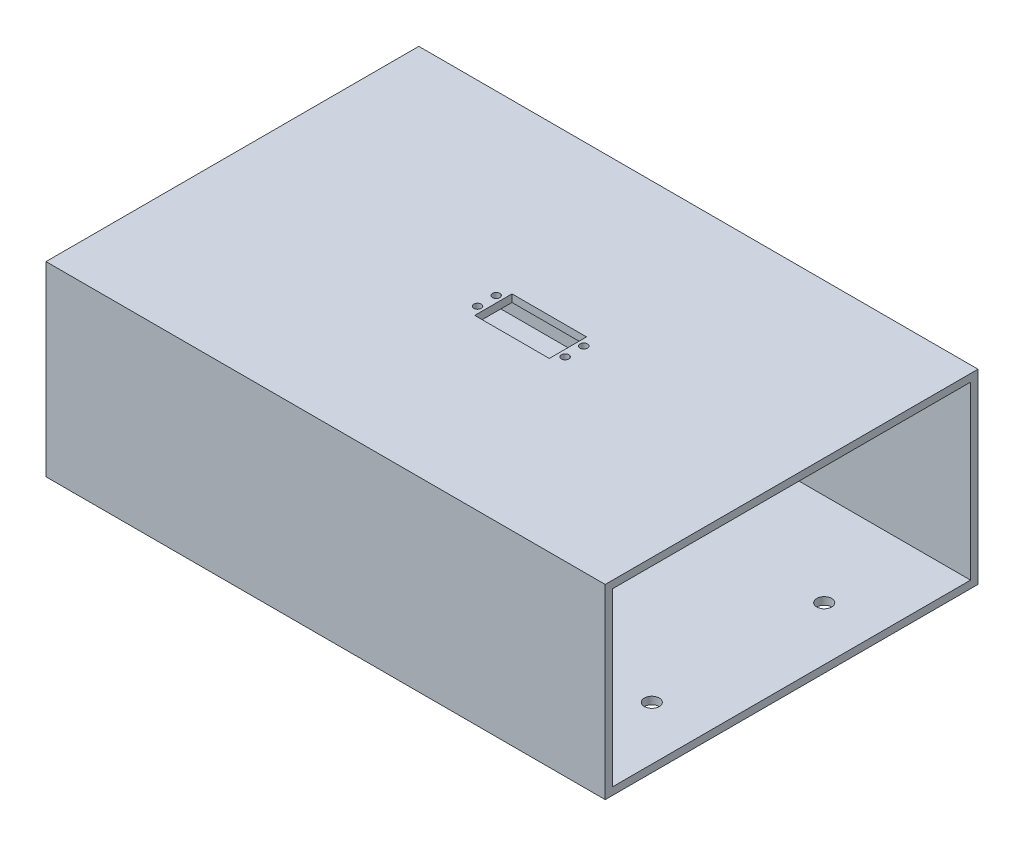
from build123d import *

# Parameters (mm, degrees)
IZIM1_W                     = 300
IZIM1_H                     = 100
Y_KSEKLIK_EKSTR_ZYON1_DEPTH = 200
BO_ALTMA1_T                 = -4
KES_EKSTR_ZYON1_REACH       = 376.166
IZIM2_R                     = 4
KES_EKSTR_ZYON2_REACH       = 376.166
IZIM3_R                     = 2
IZIM3_W                     = 40
IZIM3_H                     = 20


with BuildPart() as part:
    # Çizim1 → Yükseklik-Ekstrüzyon1 (new body)
    with BuildSketch(Plane.XY):
        with Locations((-150, 50)):
            Rectangle(IZIM1_W, IZIM1_H)
    extrude(amount=Y_KSEKLIK_EKSTR_ZYON1_DEPTH)

    # İç Boşaltma1
    bo_altma1_openings = [part.faces().sort_by_distance(p)[0] for p in [
        (-300, 50, 100),
        (0, 50, 100),
    ]]
    offset(amount=BO_ALTMA1_T, openings=bo_altma1_openings, kind=Kind.INTERSECTION)

    # Çizim2 → Kes-Ekstrüzyon1 (cut, up to next)
    with BuildSketch(Plane.XZ, mode=Mode.PRIVATE) as kes_ekstr_zyon1_sk1:
        with Locations((-271.25, 146.25)):
            Circle(IZIM2_R)
    kes_ekstr_zyon1_tool1 = extrude(kes_ekstr_zyon1_sk1.sketch, amount=-KES_EKSTR_ZYON1_REACH, mode=Mode.PRIVATE) & part.part
    # Çizim2 → Kes-Ekstrüzyon1 (cut, up to next)
    with BuildSketch(Plane.XZ, mode=Mode.PRIVATE) as kes_ekstr_zyon1_sk2:
        with Locations((-178.75, 146.25)):
            Circle(IZIM2_R)
    kes_ekstr_zyon1_tool2 = extrude(kes_ekstr_zyon1_sk2.sketch, amount=-KES_EKSTR_ZYON1_REACH, mode=Mode.PRIVATE) & part.part
    # Çizim2 → Kes-Ekstrüzyon1 (cut, up to next)
    with BuildSketch(Plane.XZ, mode=Mode.PRIVATE) as kes_ekstr_zyon1_sk3:
        with Locations(Location((-28.75, 146.25, 0), (0, 0, 180))):
            Circle(IZIM2_R)
    kes_ekstr_zyon1_tool3 = extrude(kes_ekstr_zyon1_sk3.sketch, amount=-KES_EKSTR_ZYON1_REACH, mode=Mode.PRIVATE) & part.part
    # Çizim2 → Kes-Ekstrüzyon1 (cut, up to next)
    with BuildSketch(Plane.XZ, mode=Mode.PRIVATE) as kes_ekstr_zyon1_sk4:
        with Locations(Location((-121.25, 146.25, 0), (0, 0, 180))):
            Circle(IZIM2_R)
    kes_ekstr_zyon1_tool4 = extrude(kes_ekstr_zyon1_sk4.sketch, amount=-KES_EKSTR_ZYON1_REACH, mode=Mode.PRIVATE) & part.part
    # Çizim2 → Kes-Ekstrüzyon1 (cut, up to next)
    with BuildSketch(Plane.XZ, mode=Mode.PRIVATE) as kes_ekstr_zyon1_sk5:
        with Locations((-271.25, 53.75)):
            Circle(IZIM2_R)
    kes_ekstr_zyon1_tool5 = extrude(kes_ekstr_zyon1_sk5.sketch, amount=-KES_EKSTR_ZYON1_REACH, mode=Mode.PRIVATE) & part.part
    # Çizim2 → Kes-Ekstrüzyon1 (cut, up to next)
    with BuildSketch(Plane.XZ, mode=Mode.PRIVATE) as kes_ekstr_zyon1_sk6:
        with Locations((-178.75, 53.75)):
            Circle(IZIM2_R)
    kes_ekstr_zyon1_tool6 = extrude(kes_ekstr_zyon1_sk6.sketch, amount=-KES_EKSTR_ZYON1_REACH, mode=Mode.PRIVATE) & part.part
    # Çizim2 → Kes-Ekstrüzyon1 (cut, up to next)
    with BuildSketch(Plane.XZ, mode=Mode.PRIVATE) as kes_ekstr_zyon1_sk7:
        with Locations(Location((-121.25, 53.75, 0), (0, 0, 180))):
            Circle(IZIM2_R)
    kes_ekstr_zyon1_tool7 = extrude(kes_ekstr_zyon1_sk7.sketch, amount=-KES_EKSTR_ZYON1_REACH, mode=Mode.PRIVATE) & part.part
    # Çizim2 → Kes-Ekstrüzyon1 (cut, up to next)
    with BuildSketch(Plane.XZ, mode=Mode.PRIVATE) as kes_ekstr_zyon1_sk8:
        with Locations(Location((-28.75, 53.75, 0), (0, 0, 180))):
            Circle(IZIM2_R)
    kes_ekstr_zyon1_tool8 = extrude(kes_ekstr_zyon1_sk8.sketch, amount=-KES_EKSTR_ZYON1_REACH, mode=Mode.PRIVATE) & part.part
    add(kes_ekstr_zyon1_tool1.solids().sort_by_distance((-271.25, 0, 146.25))[0], mode=Mode.SUBTRACT)
    add(kes_ekstr_zyon1_tool2.solids().sort_by_distance((-178.75, 0, 146.25))[0], mode=Mode.SUBTRACT)
    add(kes_ekstr_zyon1_tool3.solids().sort_by_distance((-28.75, 0, 146.25))[0], mode=Mode.SUBTRACT)
    add(kes_ekstr_zyon1_tool4.solids().sort_by_distance((-121.25, 0, 146.25))[0], mode=Mode.SUBTRACT)
    add(kes_ekstr_zyon1_tool5.solids().sort_by_distance((-271.25, 0, 53.75))[0], mode=Mode.SUBTRACT)
    add(kes_ekstr_zyon1_tool6.solids().sort_by_distance((-178.75, 0, 53.75))[0], mode=Mode.SUBTRACT)
    add(kes_ekstr_zyon1_tool7.solids().sort_by_distance((-121.25, 0, 53.75))[0], mode=Mode.SUBTRACT)
    add(kes_ekstr_zyon1_tool8.solids().sort_by_distance((-28.75, 0, 53.75))[0], mode=Mode.SUBTRACT)

    # Çizim3 → Kes-Ekstrüzyon2 (cut, up to next)
    with BuildSketch(Plane(origin=(0, 100, 0), x_dir=(1, 0, 0), z_dir=(0, 1, 0)), mode=Mode.PRIVATE) as kes_ekstr_zyon2_sk1:
        with Locations(Location((-116.5, -95, 0), (0, 0, 180))):
            Circle(IZIM3_R)
    kes_ekstr_zyon2_tool1 = extrude(kes_ekstr_zyon2_sk1.sketch, amount=-KES_EKSTR_ZYON2_REACH, mode=Mode.PRIVATE) & part.part
    # Çizim3 → Kes-Ekstrüzyon2 (cut, up to next)
    with BuildSketch(Plane(origin=(0, 100, 0), x_dir=(1, 0, 0), z_dir=(0, 1, 0)), mode=Mode.PRIVATE) as kes_ekstr_zyon2_sk2:
        with Locations(Location((-116.5, -105, 0), (0, 0, 180))):
            Circle(IZIM3_R)
    kes_ekstr_zyon2_tool2 = extrude(kes_ekstr_zyon2_sk2.sketch, amount=-KES_EKSTR_ZYON2_REACH, mode=Mode.PRIVATE) & part.part
    # Çizim3 → Kes-Ekstrüzyon2 (cut, up to next)
    with BuildSketch(Plane(origin=(0, 100, 0), x_dir=(1, 0, 0), z_dir=(0, 1, 0)), mode=Mode.PRIVATE) as kes_ekstr_zyon2_sk3:
        with Locations(Location((-163.5, -105, 0), (0, 0, 180))):
            Circle(IZIM3_R)
    kes_ekstr_zyon2_tool3 = extrude(kes_ekstr_zyon2_sk3.sketch, amount=-KES_EKSTR_ZYON2_REACH, mode=Mode.PRIVATE) & part.part
    # Çizim3 → Kes-Ekstrüzyon2 (cut, up to next)
    with BuildSketch(Plane(origin=(0, 100, 0), x_dir=(1, 0, 0), z_dir=(0, 1, 0)), mode=Mode.PRIVATE) as kes_ekstr_zyon2_sk4:
        with Locations(Location((-163.5, -95, 0), (0, 0, 180))):
            Circle(IZIM3_R)
    kes_ekstr_zyon2_tool4 = extrude(kes_ekstr_zyon2_sk4.sketch, amount=-KES_EKSTR_ZYON2_REACH, mode=Mode.PRIVATE) & part.part
    # Çizim3 → Kes-Ekstrüzyon2 (cut, up to next)
    with BuildSketch(Plane(origin=(0, 100, 0), x_dir=(1, 0, 0), z_dir=(0, 1, 0)), mode=Mode.PRIVATE) as kes_ekstr_zyon2_sk5:
        with Locations((-140, -100)):
            Rectangle(IZIM3_W, IZIM3_H)
    kes_ekstr_zyon2_tool5 = extrude(kes_ekstr_zyon2_sk5.sketch, amount=-KES_EKSTR_ZYON2_REACH, mode=Mode.PRIVATE) & part.part
    add(kes_ekstr_zyon2_tool1.solids().sort_by_distance((-116.5, 100, 95))[0], mode=Mode.SUBTRACT)
    add(kes_ekstr_zyon2_tool2.solids().sort_by_distance((-116.5, 100, 105))[0], mode=Mode.SUBTRACT)
    add(kes_ekstr_zyon2_tool3.solids().sort_by_distance((-163.5, 100, 105))[0], mode=Mode.SUBTRACT)
    add(kes_ekstr_zyon2_tool4.solids().sort_by_distance((-163.5, 100, 95))[0], mode=Mode.SUBTRACT)
    add(kes_ekstr_zyon2_tool5.solids().sort_by_distance((-140, 100, 100))[0], mode=Mode.SUBTRACT)


solid = part.part
